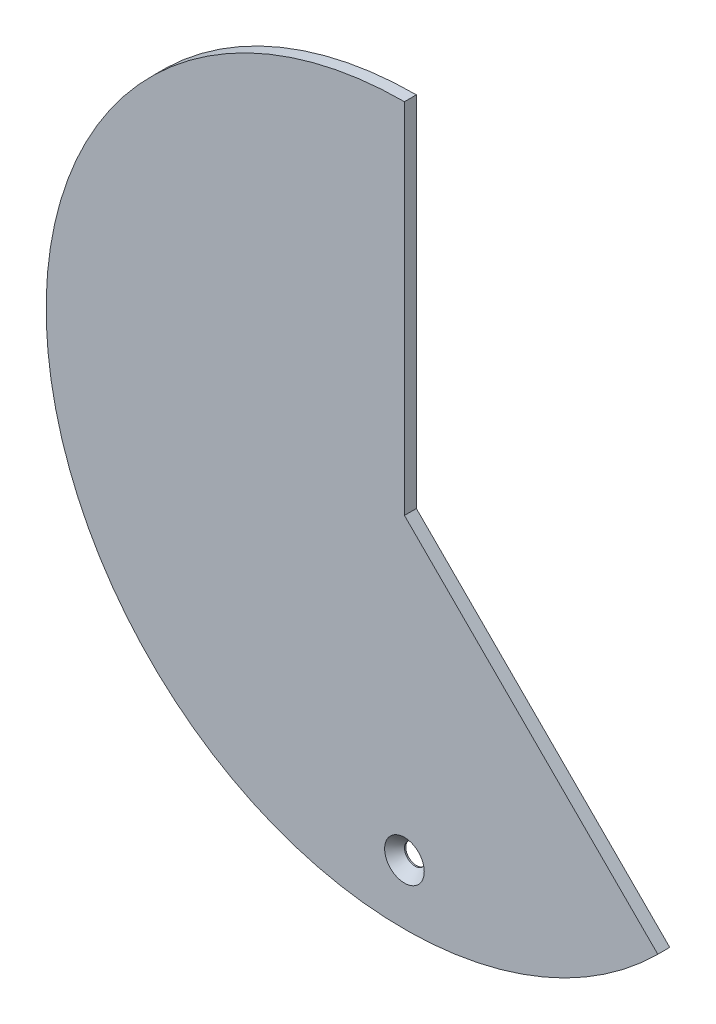
from build123d import *

# Parameters (mm, degrees)
BOSS_EXTRUDE1_DEPTH = 2.54


with BuildPart() as part:
    # Sketch1 → Boss-Extrude1 (new body)
    with BuildSketch(Plane.XY):
        with BuildLine():
            Line((0, 0), (53.881536726, -53.881536726))
            ThreePointArc((53.881536726, -53.881536726), (-70.399620377, -29.160477546), (0, 76.2))
            Line((0, 76.2), (0, 0))
        make_face()
    extrude(amount=BOSS_EXTRUDE1_DEPTH)

    # Sketch3 → CSK for #8 Flat Head Machine Screw1 (revolve, cut)
    with BuildSketch(Plane(origin=(0, -63.5, 2.54), x_dir=(0, -1, 0), z_dir=(1, 0, 0))):
        Polygon((0, 0), (0, 2.54), (2.2479, 2.54), (2.2479, 2.26450021), (4.2164, 0), align=None)
    revolve(axis=Axis((0, -63.5, 8.89), (0, 0, -1)), mode=Mode.SUBTRACT)


solid = part.part
